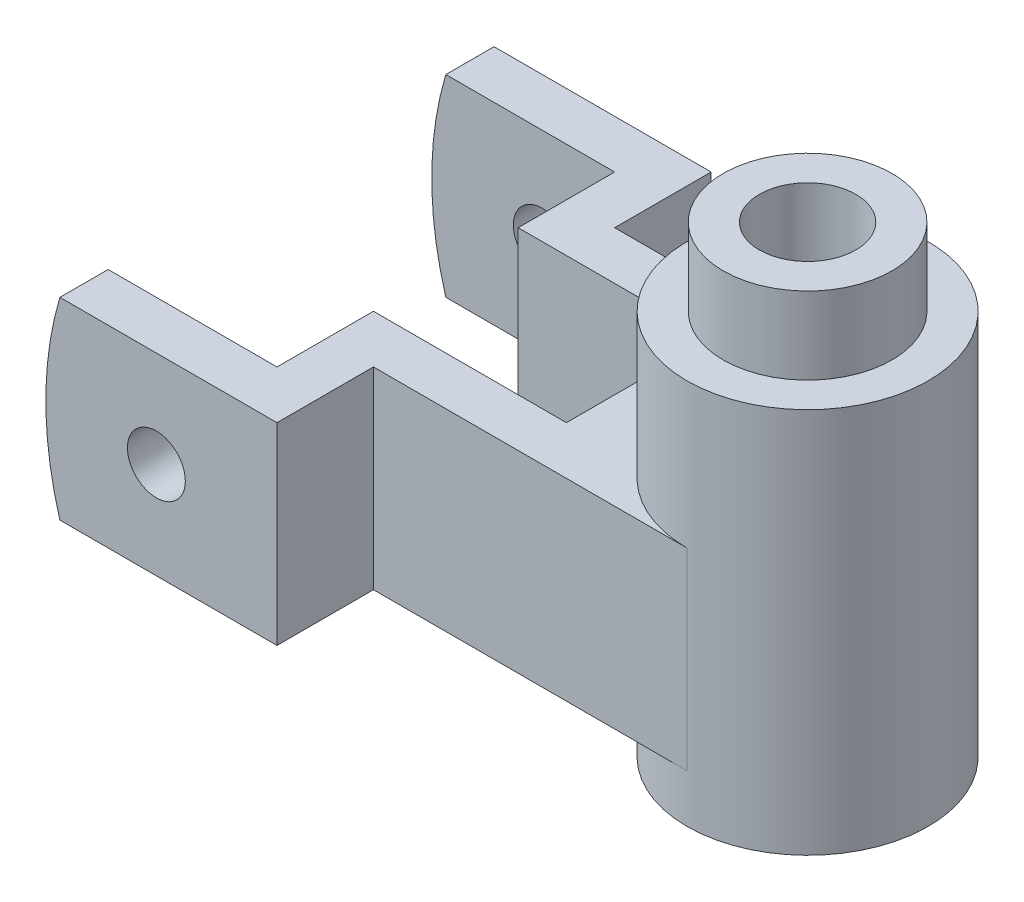
from build123d import *

# Parameters (mm, degrees)
SKETCH1_R                = 6
BOSS_EXTRUDE1_DEPTH      = 10
BOSS_EXTRUDE2_DEPTH      = 40
BOSS_EXTRUDE3_DEPTH      = 30
BOSS_EXTRUDE3_DEPTH_BACK = 50
SKETCH2_3_R              = 25
SKETCH3_R                = 17.5
BOSS_EXTRUDE4_DEPTH      = 16
SKETCH4_R                = 10
CUT_EXTRUDE1_DEPTH       = 143


with BuildPart() as part:
    # Sketch1 → Boss-Extrude1 (new body)
    with BuildSketch(Plane.XY):
        with BuildLine():
            Line((-77.756941547, 20), (-122.756941547, 20))
            ThreePointArc((-122.756941547, 20), (-125.674902222, 0), (-122.756941547, -20))
            Line((-122.756941547, -20), (-77.756941547, -20))
            Line((-77.756941547, -20), (-77.756941547, 20))
        make_face()
        with Locations((-102.756941547, 0)):
            Circle(SKETCH1_R, mode=Mode.SUBTRACT)
    boss_extrude1 = extrude(amount=BOSS_EXTRUDE1_DEPTH)

    # Sketch2 → Boss-Extrude2 (add)
    with BuildSketch(Plane(origin=(0, 20, 0), x_dir=(1, 0, 0), z_dir=(0, 1, 0))):
        with BuildLine():
            Line((-87.756941547, 0), (-77.756941547, 0))
            Line((-77.756941547, 0), (-77.756941547, 10))
            Line((-77.756941547, 10), (-12.756941547, 10))
            ThreePointArc((-12.756941547, 10), (-30.434611076, 17.32233047), (-37.756941547, 35))
            Line((-37.756941547, 35), (-47.756941547, 35))
            Line((-47.756941547, 35), (-47.756941547, 20))
            Line((-47.756941547, 20), (-87.756941547, 20))
            Line((-87.756941547, 20), (-87.756941547, 0))
        make_face()
    boss_extrude2 = extrude(amount=-BOSS_EXTRUDE2_DEPTH)

    # Sketch2<3> → Boss-Extrude3 (add, two sides: drawn at the far end of the back side and taken through both)
    with BuildSketch(Plane(origin=(0, 20, 0), x_dir=(1, 0, 0), z_dir=(0, 1, 0)).offset(-BOSS_EXTRUDE3_DEPTH_BACK)):
        with Locations(Location((-12.756941547, 35, 0), (0, 0, 270))):
            Circle(SKETCH2_3_R)
    extrude(amount=BOSS_EXTRUDE3_DEPTH + BOSS_EXTRUDE3_DEPTH_BACK)

    # Sketch3 → Boss-Extrude4 (add)
    with BuildSketch(Plane(origin=(0, 50, 0), x_dir=(1, 0, 0), z_dir=(0, 1, 0))):
        with Locations(Location((-12.756941547, 35, 0), (0, 0, 270))):
            Circle(SKETCH3_R)
    extrude(amount=BOSS_EXTRUDE4_DEPTH)

    # Sketch4 → Cut-Extrude1 (cut)
    with BuildSketch(Plane(origin=(0, 66, 0), x_dir=(1, 0, 0), z_dir=(0, 1, 0))):
        with Locations(Location((-12.756941547, 35, 0), (0, 0, 270))):
            Circle(SKETCH4_R)
    extrude(amount=-CUT_EXTRUDE1_DEPTH, mode=Mode.SUBTRACT)

    # Mirror11: Boss-Extrude2 across plane
    add(boss_extrude2.mirror(Plane(origin=(0, 0, -35), x_dir=(1, 0, 0), z_dir=(0, 0, -1))))

    # Mirror12: Boss-Extrude1 across plane
    add(boss_extrude1.mirror(Plane(origin=(0, 0, -35), x_dir=(1, 0, 0), z_dir=(0, 0, -1))))


solid = part.part
